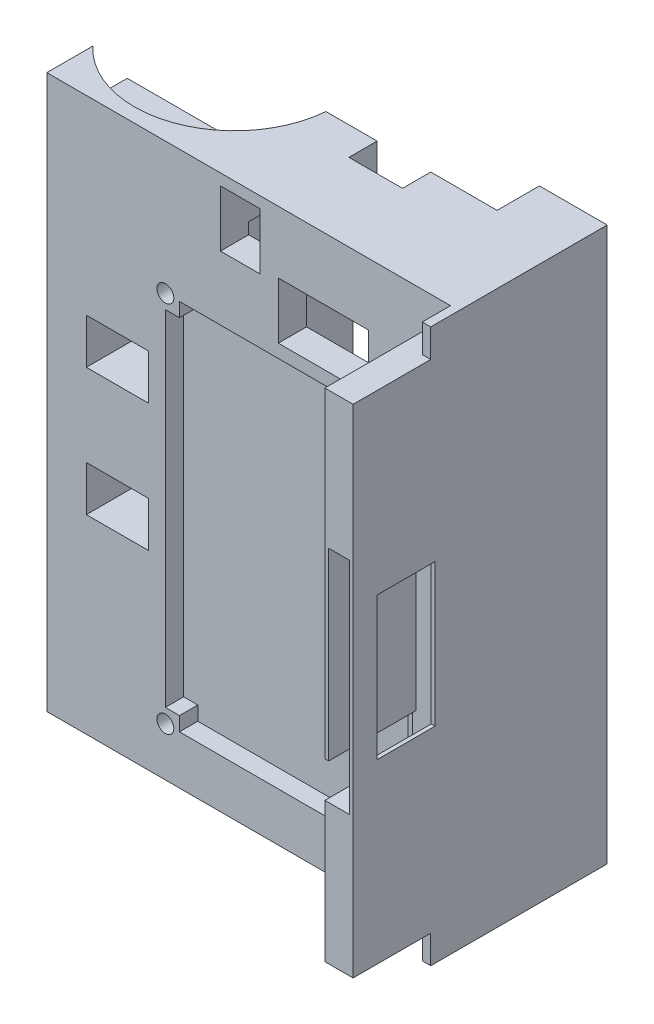
from build123d import *

# Parameters (mm, degrees)
SKETCH1_W           = 72
SKETCH1_H           = 26.25
BOSS_EXTRUDE1_DEPTH = 98
SKETCH3_W           = 24
SKETCH3_H           = 12
CUT_EXTRUDE2_DEPTH  = 98
SKETCH4_W           = 1
SKETCH4_H           = 14.25
BOSS_EXTRUDE2_DEPTH = 98
SKETCH8_R           = 17.75
CUT_EXTRUDE6_DEPTH  = 8
CUT_EXTRUDE7_START  = -8
SKETCH9_R           = 17.75
CUT_EXTRUDE7_DEPTH  = 8
SKETCH10_R          = 2.25
CUT_EXTRUDE8_DEPTH  = 4.25
SKETCH11_W          = 33
SKETCH11_H          = 67.5
CUT_EXTRUDE9_DEPTH  = 21.25
SKETCH12_W          = 33
SKETCH12_H          = 7.5
CUT_EXTRUDE10_DEPTH = 21.25
SKETCH13_W          = 9.5
SKETCH13_H          = 10
CUT_EXTRUDE11_DEPTH = 21.25
SKETCH14_W          = 5
SKETCH14_H          = 5
CUT_EXTRUDE13_DEPTH = 101.25
SKETCH17_W          = 7
SKETCH17_H          = 8
CUT_EXTRUDE14_DEPTH = 7
SKETCH18_W          = 5.398243629
SKETCH18_H          = 5.439982626
BOSS_EXTRUDE3_DEPTH = 2
SKETCH19_W          = 16
SKETCH19_H          = 10
CUT_EXTRUDE15_DEPTH = 12
SKETCH22_R          = 1.5
CUT_EXTRUDE16_DEPTH = 8.2
SKETCH23_W          = 11
SKETCH23_H          = 8
CUT_EXTRUDE18_DEPTH = 125.988249448
SKETCH25_R          = 2.25
CUT_EXTRUDE20_DEPTH = 10.25
SKETCH26_W          = 7
SKETCH26_H          = 8
CUT_EXTRUDE21_DEPTH = 124.057913195
SKETCH28_W          = 7.2
SKETCH28_H          = 8.135980894
BOSS_EXTRUDE6_DEPTH = 2
SKETCH31_R          = 1.5
CUT_EXTRUDE24_DEPTH = 3.25
SKETCH32_W          = 5
SKETCH32_H          = 98
BOSS_EXTRUDE7_DEPTH = 18.75
SKETCH34_W          = 5
SKETCH34_H          = 5
CUT_EXTRUDE27_DEPTH = 13.75
SKETCH35_W          = 3.5
SKETCH35_H          = 5
CUT_EXTRUDE28_DEPTH = 5
SKETCH37_W          = 10.25
SKETCH37_H          = 25.25
CUT_EXTRUDE29_DEPTH = 3
SKETCH36_W          = 3.65
SKETCH36_H          = 39
CUT_EXTRUDE30_DEPTH = 15.5
CUT_EXTRUDE31_DEPTH = 15.5
CUT_EXTRUDE32_DEPTH = 3.25
SKETCH41_W          = 7
SKETCH41_H          = 2.5
CUT_EXTRUDE33_DEPTH = 3
SKETCH42_W          = 7
SKETCH42_H          = 2
CUT_EXTRUDE34_DEPTH = 6
SKETCH43_W          = 3
SKETCH43_H          = 10.5
CUT_EXTRUDE35_DEPTH = 12


with BuildPart() as part:
    # Sketch1 → Boss-Extrude1 (new body)
    with BuildSketch(Plane(origin=(0, 0, 0), x_dir=(1, 0, 0), z_dir=(0, 1, 0))):
        with Locations((-36, -13.125)):
            Rectangle(SKETCH1_W, SKETCH1_H)
    extrude(amount=BOSS_EXTRUDE1_DEPTH)

    # Sketch3 → Cut-Extrude2 (cut)
    with BuildSketch(Plane.XZ):
        with Locations((-60, 6)):
            Rectangle(SKETCH3_W, SKETCH3_H)
    extrude(amount=-CUT_EXTRUDE2_DEPTH, mode=Mode.SUBTRACT)

    # Sketch4 → Boss-Extrude2 (add)
    with BuildSketch(Plane(origin=(0, 0, 0), x_dir=(-1, 0, 0), z_dir=(0, -1, 0))):
        with Locations((72.5, -19.125)):
            Rectangle(SKETCH4_W, SKETCH4_H)
    extrude(amount=-BOSS_EXTRUDE2_DEPTH)

    # Sketch8 → Cut-Extrude6 (cut)
    with BuildSketch(Plane.XZ):
        with Locations((-60, 6)):
            Circle(SKETCH8_R)
    extrude(amount=-CUT_EXTRUDE6_DEPTH, mode=Mode.SUBTRACT)

    # Sketch9 → Cut-Extrude7 (cut)
    with BuildSketch(Plane(origin=(0, 98, 0), x_dir=(1, 0, 0), z_dir=(0, 1, 0)).offset(CUT_EXTRUDE7_START)):
        with Locations((-60, -6)):
            Circle(SKETCH9_R)
    extrude(amount=CUT_EXTRUDE7_DEPTH, mode=Mode.SUBTRACT)

    # Sketch10 → Cut-Extrude8 (cut)
    with BuildSketch(Plane(origin=(0, 0, 12), x_dir=(-1, 0, 0), z_dir=(0, 0, -1))):
        with Locations((69.25, 85)):
            Circle(SKETCH10_R)
        with Locations((50.75, 85)):
            Circle(SKETCH10_R)
        with Locations((69.25, 13)):
            Circle(SKETCH10_R)
        with Locations((50.75, 13)):
            Circle(SKETCH10_R)
    extrude(amount=-CUT_EXTRUDE8_DEPTH, mode=Mode.SUBTRACT)

    # Sketch11 → Cut-Extrude9 (cut)
    with BuildSketch(Plane(origin=(0, 0, 0), x_dir=(-1, 0, 0), z_dir=(0, 0, -1))):
        with Locations((28.5, 54.25)):
            Rectangle(SKETCH11_W, SKETCH11_H)
    extrude(amount=-CUT_EXTRUDE9_DEPTH, mode=Mode.SUBTRACT)

    # Sketch12 → Cut-Extrude10 (cut)
    with BuildSketch(Plane(origin=(0, 98, 0), x_dir=(1, 0, 0), z_dir=(0, 1, 0))):
        with Locations((-28.5, -3.75)):
            Rectangle(SKETCH12_W, SKETCH12_H)
    extrude(amount=-CUT_EXTRUDE10_DEPTH, mode=Mode.SUBTRACT)

    # Sketch13 → Cut-Extrude11 (cut)
    with BuildSketch(Plane(origin=(0, 98, 0), x_dir=(1, 0, 0), z_dir=(0, 1, 0))):
        with Locations((-28.5, -7.5)):
            Rectangle(SKETCH13_W, SKETCH13_H)
    extrude(amount=-CUT_EXTRUDE11_DEPTH, mode=Mode.SUBTRACT)

    # Sketch14 → Cut-Extrude13 (cut)
    with BuildSketch(Plane(origin=(0, 20.5, 0), x_dir=(1, 0, 0), z_dir=(0, 1, 0))):
        with Locations((-39.5, -12)):
            Rectangle(SKETCH14_W, SKETCH14_H)
    extrude(amount=CUT_EXTRUDE13_DEPTH, mode=Mode.SUBTRACT)

    # Sketch17 → Cut-Extrude14 (cut)
    with BuildSketch(Plane(origin=(0, 0, 7.5), x_dir=(-1, 0, 0), z_dir=(0, 0, -1))):
        with Locations((38.75, 92)):
            Rectangle(SKETCH17_W, SKETCH17_H)
    extrude(amount=-CUT_EXTRUDE14_DEPTH, mode=Mode.SUBTRACT)

    # Sketch18 → Boss-Extrude3 (add)
    with BuildSketch(Plane(origin=(0, 98, 0), x_dir=(1, 0, 0), z_dir=(0, 1, 0))):
        with Locations((-39.480706385, -11.994977786)):
            Rectangle(SKETCH18_W, SKETCH18_H)
    extrude(amount=-BOSS_EXTRUDE3_DEPTH)

    # Sketch19 → Cut-Extrude15 (cut)
    with BuildSketch(Plane.XY.offset(26.25)):
        with Locations((-24, 82)):
            Rectangle(SKETCH19_W, SKETCH19_H)
    extrude(amount=-CUT_EXTRUDE15_DEPTH, mode=Mode.SUBTRACT)

    # Sketch22 → Cut-Extrude16 (cut)
    with BuildSketch(Plane(origin=(0, 0, 0), x_dir=(-1, 0, 0), z_dir=(0, 0, -1))):
        with Locations((6, 55.73)):
            Circle(SKETCH22_R)
        with Locations((6, 42.27)):
            Circle(SKETCH22_R)
    extrude(amount=-CUT_EXTRUDE16_DEPTH, mode=Mode.SUBTRACT)

    # Sketch23 → Cut-Extrude18 (cut, through all)
    with BuildSketch(Plane.XY.offset(26.25)):
        with Locations((-60.5, 37.7)):
            Rectangle(SKETCH23_W, SKETCH23_H)
        with Locations((-60.5, 60.3)):
            Rectangle(SKETCH23_W, SKETCH23_H)
    extrude(amount=-CUT_EXTRUDE18_DEPTH, mode=Mode.SUBTRACT)

    # Sketch25 → Cut-Extrude20 (cut)
    with BuildSketch(Plane.ZY.offset(73)):
        with Locations((19.125, 77)):
            Circle(SKETCH25_R)
        with Locations((19.125, 49)):
            Circle(SKETCH25_R)
        with Locations((19.125, 21)):
            Circle(SKETCH25_R)
    extrude(amount=-CUT_EXTRUDE20_DEPTH, mode=Mode.SUBTRACT)

    # Sketch26 → Cut-Extrude21 (cut, through all)
    with BuildSketch(Plane(origin=(0, 0, 14.5), x_dir=(-1, 0, 0), z_dir=(0, 0, -1))):
        with Locations((38.75, 92)):
            Rectangle(SKETCH26_W, SKETCH26_H)
    extrude(amount=-CUT_EXTRUDE21_DEPTH, mode=Mode.SUBTRACT)

    # Sketch28 → Boss-Extrude6 (add)
    with BuildSketch(Plane(origin=(0, 0, 7.5), x_dir=(-1, 0, 0), z_dir=(0, 0, -1))):
        with Locations((38.666345703, 92.067990447)):
            Rectangle(SKETCH28_W, SKETCH28_H)
    extrude(amount=-BOSS_EXTRUDE6_DEPTH)

    # Sketch31 → Cut-Extrude24 (cut)
    with BuildSketch(Plane.XY.offset(26.25)):
        with Locations((-52.007752906, 74.651528785)):
            Circle(SKETCH31_R)
        with Locations((-9.007752906, 74.651528785)):
            Circle(SKETCH31_R)
        with Locations((-9.007752906, 8.625682812)):
            Circle(SKETCH31_R)
        with Locations((-52.007752906, 8.625682812)):
            Circle(SKETCH31_R)
    extrude(amount=-CUT_EXTRUDE24_DEPTH, mode=Mode.SUBTRACT)

    # Sketch32 → Boss-Extrude7 (add)
    with BuildSketch(Plane.XY.offset(26.25)):
        with Locations((-2.5, 49)):
            Rectangle(SKETCH32_W, SKETCH32_H)
    extrude(amount=BOSS_EXTRUDE7_DEPTH)

    # Sketch34 → Cut-Extrude27 (cut)
    with BuildSketch(Plane.XY.offset(45)):
        with Locations((-2.5, 95.5)):
            Rectangle(SKETCH34_W, SKETCH34_H)
        with Locations((-2.5, 2.5)):
            Rectangle(SKETCH34_W, SKETCH34_H)
    extrude(amount=-CUT_EXTRUDE27_DEPTH, mode=Mode.SUBTRACT)

    # Sketch35 → Cut-Extrude28 (cut)
    with BuildSketch(Plane.XY.offset(31.25)):
        with Locations((-3.25, 95.5)):
            Rectangle(SKETCH35_W, SKETCH35_H)
        with Locations((-3.25, 2.5)):
            Rectangle(SKETCH35_W, SKETCH35_H)
    extrude(amount=-CUT_EXTRUDE28_DEPTH, mode=Mode.SUBTRACT)

    # Sketch37 → Cut-Extrude29 (cut)
    with BuildSketch(Plane(origin=(0, 0, 0), x_dir=(0, 0, -1), z_dir=(1, 0, 0))):
        with Locations((-35.625, 49)):
            Rectangle(SKETCH37_W, SKETCH37_H)
    extrude(amount=-CUT_EXTRUDE29_DEPTH, mode=Mode.SUBTRACT)

    # Sketch36 → Cut-Extrude30 (cut)
    with BuildSketch(Plane.XY.offset(45)):
        with Locations((-2.5, 49.25)):
            Rectangle(SKETCH36_W, SKETCH36_H)
    extrude(amount=-CUT_EXTRUDE30_DEPTH, mode=Mode.SUBTRACT)

    # Sketch38 → Cut-Extrude31 (cut)
    with BuildSketch(Plane.XY.offset(45)):
        Polygon((-4.325, 30.125), (-4.325, 29.75), (-5, 29.75), (-5.005, 30.125), (-5.005, 36.125), (-4.325, 36.125), align=None)
    extrude(amount=-CUT_EXTRUDE31_DEPTH, mode=Mode.SUBTRACT)

    # Sketch39 → Cut-Extrude32 (cut)
    with BuildSketch(Plane.XY.offset(26.25)):
        Polygon((-49.507752906, 72.151528785), (-52.007752906, 72.151528785), (-52.007752906, 11.125682812), (-49.507752906, 11.125682812), (-49.507752906, 8.625682812), (-11.507752906, 8.625682812), (-11.507752906, 11.125682812), (-9.007752906, 11.125682812), (-9.007752906, 72.151528785), (-11.507752906, 72.151528785), (-11.507752906, 74.651528785), (-49.507752906, 74.651528785), align=None)
    extrude(amount=-CUT_EXTRUDE32_DEPTH, mode=Mode.SUBTRACT)

    # Sketch41 → Cut-Extrude33 (cut)
    with BuildSketch(Plane(origin=(0, 0, 7.5), x_dir=(-1, 0, 0), z_dir=(0, 0, -1))):
        with Locations((38.75, 89.25)):
            Rectangle(SKETCH41_W, SKETCH41_H)
    extrude(amount=-CUT_EXTRUDE33_DEPTH, mode=Mode.SUBTRACT)

    # Sketch42 → Cut-Extrude34 (cut)
    with BuildSketch(Plane.XY.offset(26.25)):
        with Locations((-38.75, 87)):
            Rectangle(SKETCH42_W, SKETCH42_H)
    extrude(amount=-CUT_EXTRUDE34_DEPTH, mode=Mode.SUBTRACT)

    # Sketch43 → Cut-Extrude35 (cut)
    with BuildSketch(Plane(origin=(0, 0, 0), x_dir=(-1, 0, 0), z_dir=(0, 0, -1))):
        with Locations((46.5, 84.75)):
            Rectangle(SKETCH43_W, SKETCH43_H)
        with Locations((46.5, 13.25)):
            Rectangle(SKETCH43_W, SKETCH43_H)
    extrude(amount=-CUT_EXTRUDE35_DEPTH, mode=Mode.SUBTRACT)


solid = part.part
